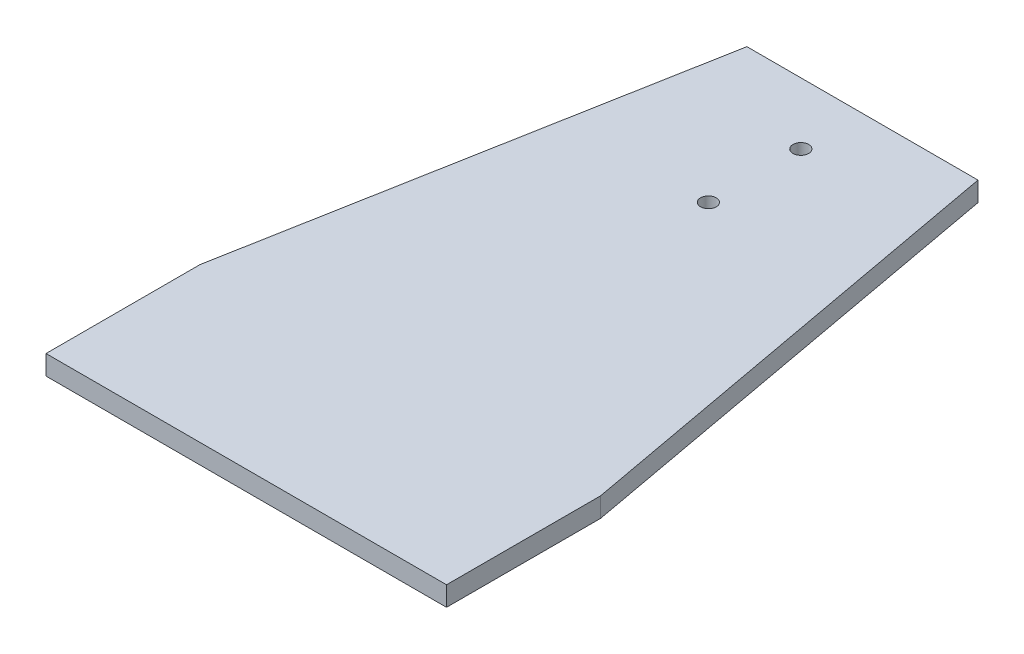
from build123d import *

# Parameters (mm, degrees)
SKETCH1_R           = 2.55
BOSS_EXTRUDE1_DEPTH = 6.35


with BuildPart() as part:
    # Sketch1 → Boss-Extrude1 (new body)
    with BuildSketch(Plane(origin=(0, 0, 0), x_dir=(1, 0, 0), z_dir=(0, 1, 0))):
        Polygon((-37.5, 175), (37.5, 175), (65, 25), (65, -25), (-65, -25), (-65, 25), align=None)
        with Locations(Location((0, 155, 0), (0, 0, 270))):
            Circle(SKETCH1_R, mode=Mode.SUBTRACT)
        with Locations(Location((0, 125, 0), (0, 0, 270))):
            Circle(SKETCH1_R, mode=Mode.SUBTRACT)
    extrude(amount=BOSS_EXTRUDE1_DEPTH)


solid = part.part
